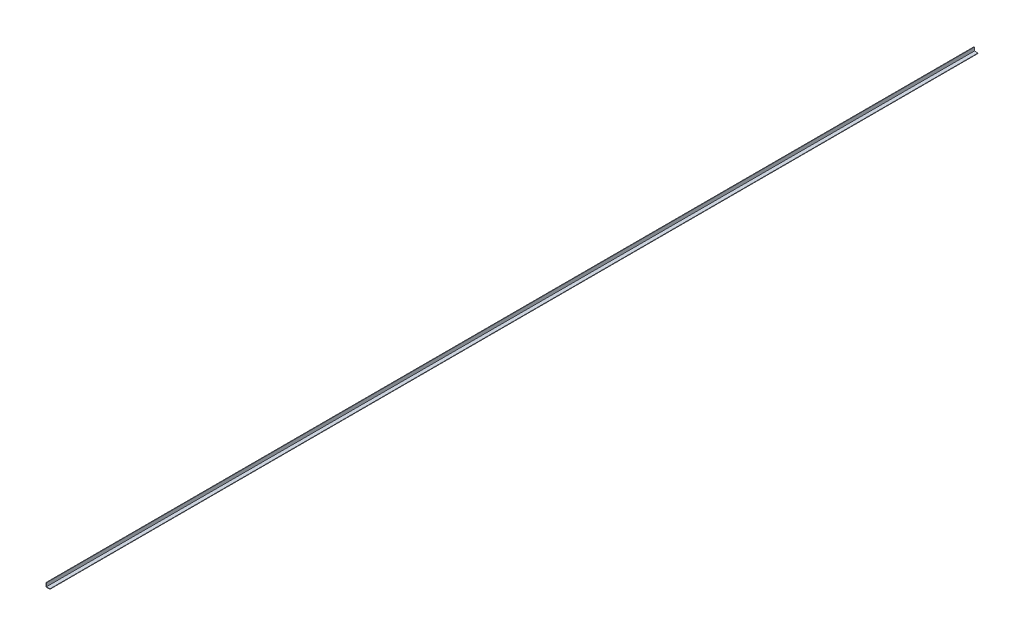
from build123d import *

# Parameters (mm, degrees)
SALIENTE_EXTRUIR1_DEPTH = 6100


with BuildPart() as part:
    # Croquis1 → Saliente-Extruir1 (new body)
    with BuildSketch(Plane.XY):
        Polygon((0, 25.8), (0, 0), (25.8, 0), (25.8, 2.7), (2.7, 2.7), (2.7, 25.8), align=None)
    extrude(amount=-SALIENTE_EXTRUIR1_DEPTH)


solid = part.part
